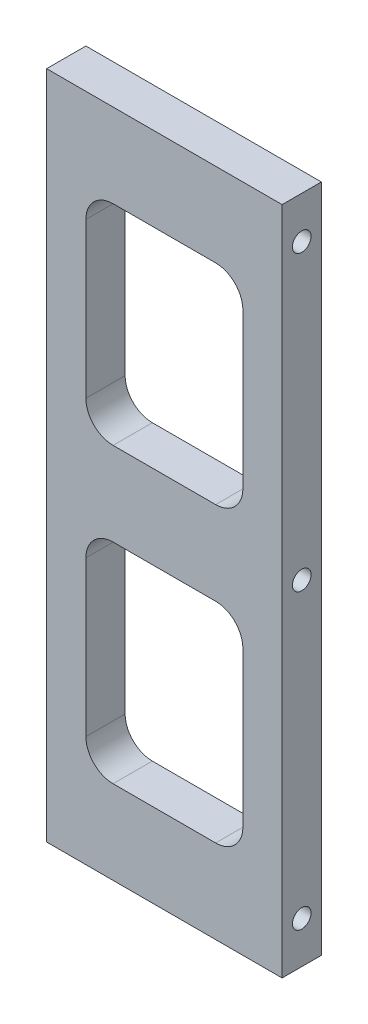
from build123d import *

# Parameters (mm, degrees)
SKETCH1_W             = 28.575
SKETCH1_H             = 81.28
BOSS_EXTRUDE1_DEPTH   = 4.7625
SKETCH2_W             = 19.05
SKETCH2_H             = 25.4
CUT_EXTRUDE1_DEPTH    = 44.340785209
FILLET1_R             = 3.302
F_4_40_TAPPED_HOLE1_D = 2.2606


with BuildPart() as part:
    # Sketch1 → Boss-Extrude1 (new body)
    with BuildSketch(Plane.XY):
        Rectangle(SKETCH1_W, SKETCH1_H)
    extrude(amount=BOSS_EXTRUDE1_DEPTH)

    # Sketch2 → Cut-Extrude1 (cut, through all)
    with BuildSketch(Plane.XY.offset(4.7625)):
        with Locations((0, 17.78)):
            Rectangle(SKETCH2_W, SKETCH2_H)
        with Locations((0, -17.78)):
            Rectangle(SKETCH2_W, SKETCH2_H)
    extrude(amount=-CUT_EXTRUDE1_DEPTH, mode=Mode.SUBTRACT)

    # Fillet1
    fillet1_edges = [part.edges().sort_by_distance(p)[0] for p in [
        (9.525, 30.48, 2.38125),
        (9.525, 5.08, 2.38125),
        (-9.525, 5.08, 2.38125),
        (-9.525, 30.48, 2.38125),
        (-9.525, -30.48, 2.38125),
        (-9.525, -5.08, 2.38125),
        (9.525, -5.08, 2.38125),
        (9.525, -30.48, 2.38125),
    ]]
    fillet(fillet1_edges, radius=FILLET1_R)

    # #4-40 Tapped Hole1 (through all)
    with Locations(Plane(origin=(14.2875, 0, 0), x_dir=(0, 0, -1), z_dir=(1, 0, 0))):
        with Locations((-2.38125, 35.56), (-2.38125, 0), (-2.38125, -35.56)):
            Hole(F_4_40_TAPPED_HOLE1_D / 2)


solid = part.part
